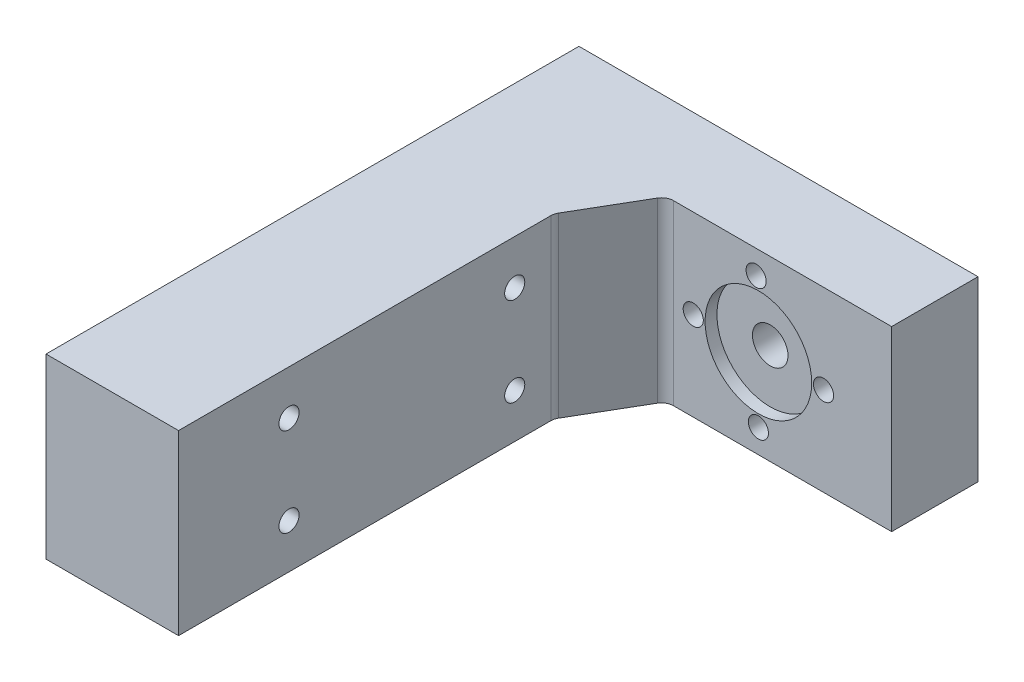
from build123d import *

# Parameters (mm, degrees)
BOSS_EXTRUDE1_DEPTH = 300
SKETCH3_R           = 17
SKETCH3_R_2         = 30
CUT_EXTRUDE1_DEPTH  = 1055.907875982
SKETCH4_R           = 90
CUT_EXTRUDE2_DEPTH  = 20
SKETCH5_R           = 17
CUT_EXTRUDE3_DEPTH  = 1051
CHAMFER1_SIZE       = 70
CHAMFER1_SIZE2      = 120
FILLET1_R           = 20
SCALE1_SCALE        = 0.1


with BuildPart() as part:
    # Sketch2 → Boss-Extrude1 (new body)
    with BuildSketch(Plane(origin=(0, 0, 0), x_dir=(-1, 0, 0), z_dir=(0, 1, 0))):
        Polygon((0, 0), (673.85334868, 0), (673.85334868, 900), (450, 900), (450, 145.843324447), (0, 145.843324447), align=None)
    extrude(amount=BOSS_EXTRUDE1_DEPTH)

    # Sketch3 → Cut-Extrude1 (cut, through all)
    with BuildSketch(Plane.XY.offset(145.843324447)):
        with Locations((-335, 150)):
            Circle(SKETCH3_R)
        with Locations((-228.822978678, 259.933547355)):
            Circle(SKETCH3_R)
        with Locations((-115, 150)):
            Circle(SKETCH3_R)
        with Locations((-225, 40)):
            Circle(SKETCH3_R)
        with Locations((-225, 150)):
            Circle(SKETCH3_R_2)
    extrude(amount=-CUT_EXTRUDE1_DEPTH, mode=Mode.SUBTRACT)

    # Sketch4 → Cut-Extrude2 (cut)
    with BuildSketch(Plane.XY.offset(145.843324447)):
        with Locations((-225, 150)):
            Circle(SKETCH4_R)
    extrude(amount=-CUT_EXTRUDE2_DEPTH, mode=Mode.SUBTRACT)

    # Sketch5 → Cut-Extrude3 (cut, through all)
    with BuildSketch(Plane.YZ.offset(-450)):
        with Locations(Location((75, 713.5, 0), (0, 0, 270))):
            Circle(SKETCH5_R)
        with Locations(Location((225, 713.5, 0), (0, 0, 270))):
            Circle(SKETCH5_R)
        with Locations(Location((75, 332.343324447, 0), (0, 0, 270))):
            Circle(SKETCH5_R)
        with Locations(Location((225, 332.343324447, 0), (0, 0, 270))):
            Circle(SKETCH5_R)
    extrude(amount=-CUT_EXTRUDE3_DEPTH, mode=Mode.SUBTRACT)

    # Chamfer1
    chamfer1_edges = [part.edges().sort_by_distance(p)[0] for p in [
        (-450, 150, 145.843324447),
    ]]
    chamfer1_side = [part.faces().sort_by_distance(p)[0] for p in [
        (-444.591673087, 150, 145.843324447),
    ]]
    chamfer(chamfer1_edges, length=CHAMFER1_SIZE, length2=CHAMFER1_SIZE2, reference=chamfer1_side[0])

    # Fillet1
    fillet1_edges = [part.edges().sort_by_distance(p)[0] for p in [
        (-380, 150, 145.843324447),
        (-450, 150, 265.843324447),
    ]]
    fillet(fillet1_edges, radius=FILLET1_R)


with BuildPart() as part_1:
    # Scale1: scaled about (-481.914690358, 150.000111117, 357.549237265)
    add(part.part.scale(SCALE1_SCALE).moved(Location((-433.723221322, 135.000100005, 321.794313538))))


solid = part_1.part
